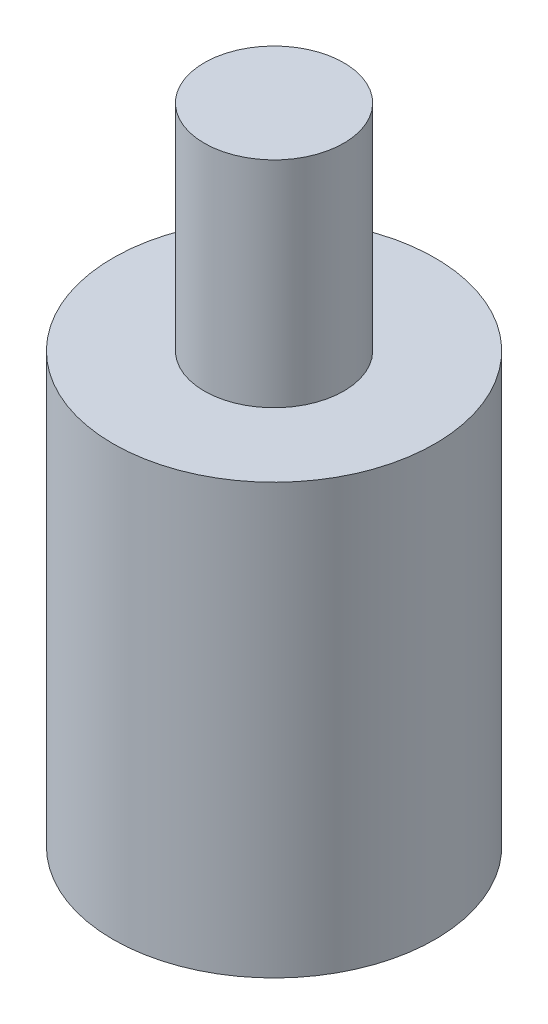
from build123d import *

# Parameters (mm, degrees)
SKETCH1_R           = 3
BOSS_EXTRUDE2_DEPTH = 8
SKETCH3_R           = 1.3
BOSS_EXTRUDE3_DEPTH = 4
SKETCH4_R           = 1.75
CUT_EXTRUDE1_DEPTH  = 6


with BuildPart() as part:
    # Sketch1 → Boss-Extrude2 (new body)
    with BuildSketch(Plane(origin=(0, 0, 0), x_dir=(1, 0, 0), z_dir=(0, 1, 0))):
        with Locations(Location((0, 0, 0), (0, 0, 270))):
            Circle(SKETCH1_R)
    extrude(amount=BOSS_EXTRUDE2_DEPTH)

    # Sketch3 → Boss-Extrude3 (add)
    with BuildSketch(Plane(origin=(0, 8, 0), x_dir=(1, 0, 0), z_dir=(0, 1, 0))):
        with Locations(Location((0, 0, 0), (0, 0, 270))):
            Circle(SKETCH3_R)
    extrude(amount=BOSS_EXTRUDE3_DEPTH)

    # Sketch4 → Cut-Extrude1 (cut)
    with BuildSketch(Plane.XZ):
        with Locations(Location((0, 0, 0), (0, 0, 270))):
            Circle(SKETCH4_R)
    extrude(amount=-CUT_EXTRUDE1_DEPTH, mode=Mode.SUBTRACT)


solid = part.part
